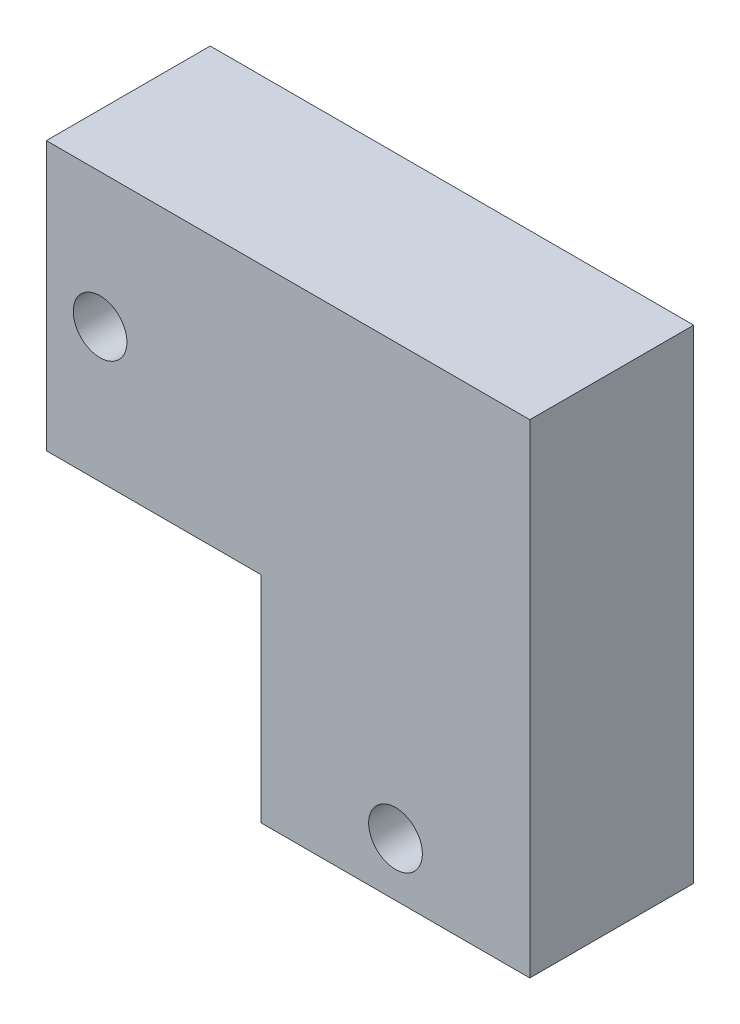
from build123d import *

# Parameters (mm, degrees)
SKETCH1_W           = 25
SKETCH1_H           = 25
BOSS_EXTRUDE1_DEPTH = 22.5
SKETCH4_W           = 25
SKETCH4_H           = 25
BOSS_EXTRUDE2_DEPTH = 20
CUT_EXTRUDE2_DEPTH  = 42.5
CUT_EXTRUDE3_DEPTH  = 21
SKETCH6_R           = 2.25
CUT_EXTRUDE4_DEPTH  = 10
SKETCH8_W           = 45
SKETCH8_H           = 9.75
CUT_EXTRUDE5_DEPTH  = 50
SKETCH10_R          = 2.5
CUT_EXTRUDE7_DEPTH  = 10
CUT_EXTRUDE8_DEPTH  = 2.6


with BuildPart() as part:
    # Sketch1 → Boss-Extrude1 (new, symmetric)
    with BuildSketch(Plane(origin=(0, 0, 0), x_dir=(1, 0, 0), z_dir=(0, 1, 0))):
        Rectangle(SKETCH1_W, SKETCH1_H)
    extrude(amount=BOSS_EXTRUDE1_DEPTH, both=True)

    # Sketch4 → Boss-Extrude2 (add)
    with BuildSketch(Plane.ZY.offset(12.5)):
        with Locations((0, 10)):
            Rectangle(SKETCH4_W, SKETCH4_H)
    extrude(amount=BOSS_EXTRUDE2_DEPTH)

    # Sketch3 → Cut-Extrude2 (cut)
    with BuildSketch(Plane.XZ.offset(22.5)):
        Polygon((-2.75, 4.75), (-2.75, 10.25), (-10.25, 10.25), (-10.25, 2.75), (-4.75, 2.75), (-4.75, -2.75), (-10.25, -2.75), (-10.25, -10.25), (-2.75, -10.25), (-2.75, -4.75), (2.75, -4.75), (2.75, -10.25), (10.25, -10.25), (10.25, -2.75), (4.75, -2.75), (4.75, 2.75), (10.25, 2.75), (10.25, 10.25), (2.75, 10.25), (2.75, 4.75), align=None)
    extrude(amount=-CUT_EXTRUDE2_DEPTH, mode=Mode.SUBTRACT)

    # Sketch5 → Cut-Extrude3 (cut)
    with BuildSketch(Plane.ZY.offset(32.5)):
        Polygon((-10.5, 7.25), (-10.5, -0.5), (-2.75, -0.5), (-2.75, 5), (2.75, 5), (2.75, -0.5), (10.5, -0.5), (10.5, 7.25), (5, 7.25), (5, 12.75), (10.5, 12.75), (10.5, 20.5), (2.75, 20.5), (2.75, 15), (-2.75, 15), (-2.75, 20.5), (-10.5, 20.5), (-10.5, 12.75), (-5, 12.75), (-5, 7.25), align=None)
    extrude(amount=-CUT_EXTRUDE3_DEPTH, mode=Mode.SUBTRACT)

    # Sketch6 → Cut-Extrude4 (cut)
    with BuildSketch(Plane(origin=(0, 0, -12.5), x_dir=(-1, 0, 0), z_dir=(0, 0, -1))):
        with Locations((0, -12.5)):
            Circle(SKETCH6_R)
        with Locations((22.5, 10)):
            Circle(SKETCH6_R)
    extrude(amount=-CUT_EXTRUDE4_DEPTH, mode=Mode.SUBTRACT)

    # Sketch8 → Cut-Extrude5 (cut)
    with BuildSketch(Plane(origin=(0, 22.5, 0), x_dir=(1, 0, 0), z_dir=(0, 1, 0))):
        with Locations((-10, 7.625)):
            Rectangle(SKETCH8_W, SKETCH8_H)
    extrude(amount=-CUT_EXTRUDE5_DEPTH, mode=Mode.SUBTRACT)

    # Sketch10 → Cut-Extrude7 (cut)
    with BuildSketch(Plane.XY.offset(12.5)):
        with Locations((-27.5, 10)):
            Circle(SKETCH10_R)
        with Locations((0, -17.5)):
            Circle(SKETCH10_R)
    extrude(amount=-CUT_EXTRUDE7_DEPTH, mode=Mode.SUBTRACT)

    # Sketch11 → Cut-Extrude8 (cut)
    with BuildSketch(Plane(origin=(0, 0, 4.75), x_dir=(-1, 0, 0), z_dir=(0, 0, -1))):
        Polygon((2.222626661, -13.550219745), (-2.309296709, -13.600258721), (-4.53192337, -17.550038976), (-2.222626661, -21.449780255), (2.309296709, -21.399741279), (4.53192337, -17.449961024), align=None)
        Polygon((31.438967259, 12.241733763), (27.528085243, 14.532112593), (23.589117983, 12.29037883), (23.561032741, 7.758266237), (27.471914757, 5.467887407), (31.410882017, 7.70962117), align=None)
    extrude(amount=-CUT_EXTRUDE8_DEPTH, mode=Mode.SUBTRACT)


solid = part.part
